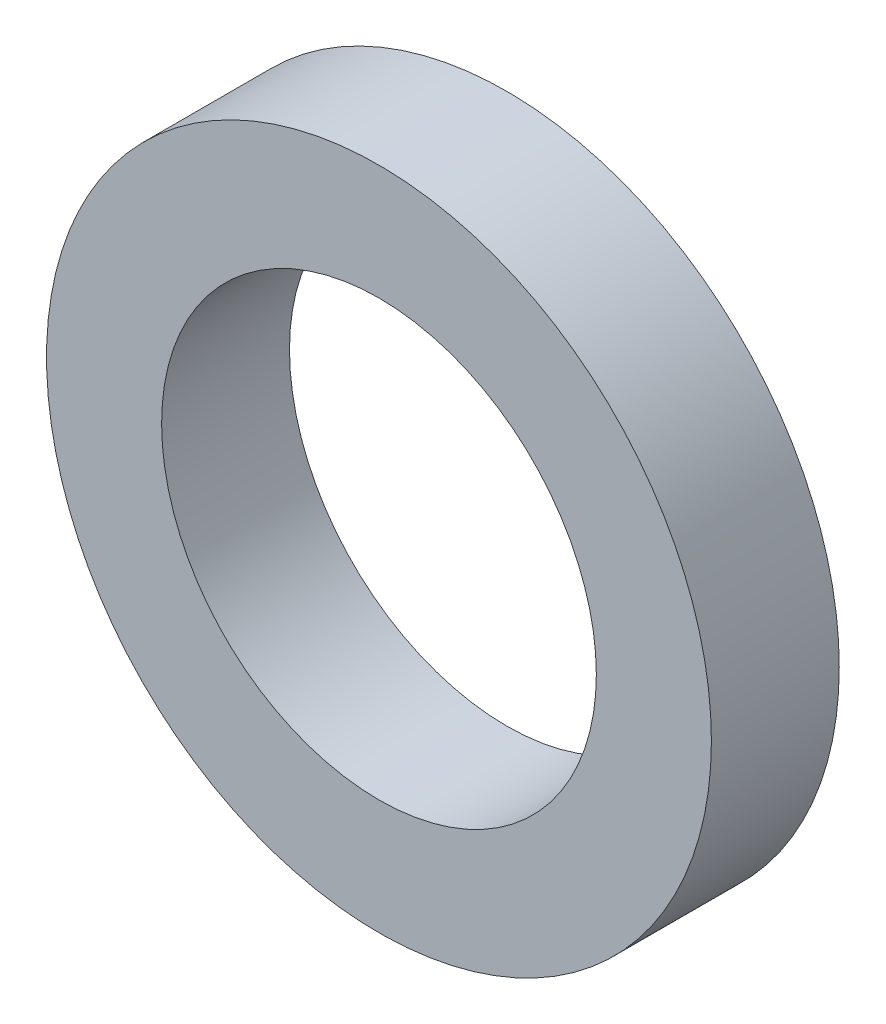
from build123d import *

# Parameters (mm, degrees)
SKETCH1_R           = 13
SKETCH1_R_2         = 8.5
BOSS_EXTRUDE1_DEPTH = 5


with BuildPart() as part:
    # Sketch1 → Boss-Extrude1 (new body)
    with BuildSketch(Plane.XY):
        Circle(SKETCH1_R)
        Circle(SKETCH1_R_2, mode=Mode.SUBTRACT)
    extrude(amount=BOSS_EXTRUDE1_DEPTH)


solid = part.part
